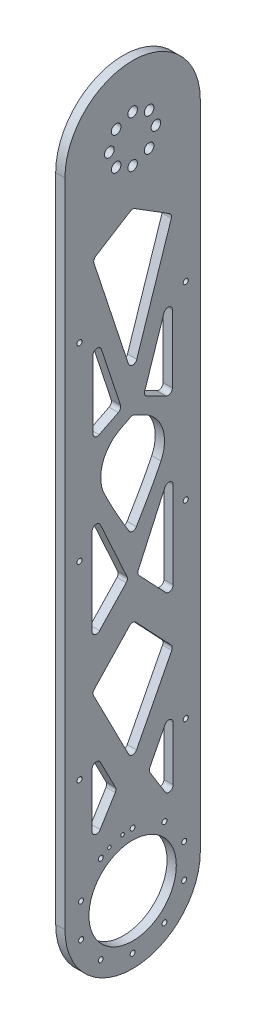
from build123d import *

# Parameters (mm, degrees)
SKETCH1_R                            = 3.3
SKETCH1_R_2                          = 1.7
SKETCH1_R_3                          = 26
BOSS_EXTRUDE1_DEPTH                  = 6.35
CUT_EXTRUDE1_DEPTH                   = 549.511460682
FILLET1_R                            = 3
SKETCH4_R                            = 1.75
CUT_EXTRUDE2_DEPTH                   = 549.511460792
SKETCH5_R                            = 1.2
CUT_EXTRUDE4_DEPTH                   = 549.511460792
BOSS_EXTRUDE2_START                  = -6.35
BOSS_EXTRUDE2_DEPTH                  = 6.35
TAP_DRILL_FOR_M3X0_5_TAP1_AT_2_COUNT = 2
TAP_DRILL_FOR_M3X0_5_TAP1_AT_2_PITCH = 13.03070812
CIRPATTERN1_COUNT                    = 2
CIRPATTERN1_ANGLE                    = 90
CUT_EXTRUDE5_DEPTH                   = 549.511460792
SKETCH10_R                           = 30
CUT_EXTRUDE6_DEPTH                   = 549.511460792
SKETCH11_W                           = 93
SKETCH11_H                           = 52.717688801
CUT_EXTRUDE7_DEPTH                   = 549.511460792
BOSS_EXTRUDE3_DEPTH                  = 6.35
SKETCH13_R                           = 1.75
CUT_EXTRUDE8_DEPTH                   = 549.511460792
SKETCH14_R                           = 1.75
BOSS_EXTRUDE4_DEPTH                  = 6.35


with BuildPart() as part:
    # Sketch1 → Boss-Extrude1 (new body)
    with BuildSketch(Plane(origin=(0, 0, 0), x_dir=(0, -1, 0), z_dir=(1, 0, 0))):
        with BuildLine():
            Line((0, 46.5), (500, 46.5))
            ThreePointArc((500, 46.5), (546.5, 0), (500, -46.5))
            Line((500, -46.5), (0, -46.5))
            ThreePointArc((0, -46.5), (-46.5, 0), (0, 46.5))
        make_face()
        with Locations(Location((-16, 0, 0), (0, 0, 90))):
            Circle(SKETCH1_R, mode=Mode.SUBTRACT)
        with Locations(Location((-11.313708499, 11.313708499, 0), (0, 0, 90))):
            Circle(SKETCH1_R, mode=Mode.SUBTRACT)
        with Locations(Location((0, 16, 0), (0, 0, 90))):
            Circle(SKETCH1_R, mode=Mode.SUBTRACT)
        with Locations(Location((11.313708499, 11.313708499, 0), (0, 0, 90))):
            Circle(SKETCH1_R, mode=Mode.SUBTRACT)
        with Locations(Location((16, 0, 0), (0, 0, 90))):
            Circle(SKETCH1_R, mode=Mode.SUBTRACT)
        with Locations(Location((11.313708499, -11.313708499, 0), (0, 0, 90))):
            Circle(SKETCH1_R, mode=Mode.SUBTRACT)
        with Locations(Location((537.25, 0, 0), (0, 0, 90))):
            Circle(SKETCH1_R_2, mode=Mode.SUBTRACT)
        with Locations(Location((530.13588304, -21.895000648, 0), (0, 0, 90))):
            Circle(SKETCH1_R_2, mode=Mode.SUBTRACT)
        with Locations(Location((511.51088304, -35.426855232, 0), (0, 0, 90))):
            Circle(SKETCH1_R_2, mode=Mode.SUBTRACT)
        with Locations(Location((488.48911696, -35.426855232, 0), (0, 0, 90))):
            Circle(SKETCH1_R_2, mode=Mode.SUBTRACT)
        with Locations(Location((469.86411696, -21.895000648, 0), (0, 0, 90))):
            Circle(SKETCH1_R_2, mode=Mode.SUBTRACT)
        with Locations(Location((462.75, 0, 0), (0, 0, 90))):
            Circle(SKETCH1_R_2, mode=Mode.SUBTRACT)
        with Locations(Location((469.86411696, 21.895000648, 0), (0, 0, 90))):
            Circle(SKETCH1_R_2, mode=Mode.SUBTRACT)
        with Locations(Location((488.48911696, 35.426855232, 0), (0, 0, 90))):
            Circle(SKETCH1_R_2, mode=Mode.SUBTRACT)
        with Locations(Location((511.51088304, 35.426855232, 0), (0, 0, 90))):
            Circle(SKETCH1_R_2, mode=Mode.SUBTRACT)
        with Locations(Location((530.13588304, 21.895000648, 0), (0, 0, 90))):
            Circle(SKETCH1_R_2, mode=Mode.SUBTRACT)
        with Locations(Location((500, 0, 0), (0, 0, 90))):
            Circle(SKETCH1_R_3, mode=Mode.SUBTRACT)
        with Locations(Location((0, -16, 0), (0, 0, 90))):
            Circle(SKETCH1_R, mode=Mode.SUBTRACT)
        with Locations(Location((-11.313708499, -11.313708499, 0), (0, 0, 90))):
            Circle(SKETCH1_R, mode=Mode.SUBTRACT)
    extrude(amount=BOSS_EXTRUDE1_DEPTH)

    # Sketch3 → Cut-Extrude1 (cut, through all)
    with BuildSketch(Plane(origin=(6.35, 0, 0), x_dir=(0, 0, -1), z_dir=(1, 0, 0))):
        Polygon((0, -422.848022722), (27.858212922, -368.632839363), (0, -339.139268075), (-27.858212922, -368.632839363), align=None)
        Polygon((0, -41.368651369), (-27.312924288, -58.435222232), (0, -141.248998295), (27.312924288, -58.435222232), align=None)
        Polygon((3, -313.189087212), (27.858212922, -339.506549748), (27.858212922, -258.646044282), align=None)
        Polygon((-27.858212922, -339.506549748), (-27.858212922, -258.646044282), (-3, -313.189087212), align=None)
        Polygon((-27.858212922, -401.452857349), (-11, -434.260816252), (-27.858212922, -461.481824785), align=None)
        Polygon((11, -434.260816252), (27.858212922, -461.481824785), (27.858212922, -401.452857349), align=None)
        with BuildLine():
            Line((0, -164.248853344), (-27.858212922, -178.200474573))
            add(Edge.make_bspline(
                [(-27.858212922, -178.200474573), (-43.7790539, -216.093343216), (-18.61661693, -258.276071598), (0, -289.085024731)],
                knots=[0, 0, 0, 0, 1, 1, 1, 1], degree=3))
            add(Edge.make_bspline(
                [(27.858212922, -178.200474573), (43.7790539, -216.093343216), (18.61661693, -258.276071598), (0, -289.085024731)],
                knots=[0, 0, 0, 0, 1, 1, 1, 1], degree=3))
            Line((27.858212922, -178.200474573), (0, -164.248853344))
        make_face()
        Polygon((7.5, -156.820958214), (27.312924288, -96.747453897), (27.312924288, -166.743432993), align=None)
        Polygon((-27.312924288, -96.747453897), (-27.312924288, -166.743432993), (-7.5, -156.820958214), align=None)
    extrude(amount=-CUT_EXTRUDE1_DEPTH, mode=Mode.SUBTRACT)

    # Fillet1
    fillet1_edges = [part.edges().sort_by_distance(p)[0] for p in [
        (3.175, -58.435222232, -27.312924288),
        (3.175, -41.368651369, 0),
        (3.175, -58.435222232, 27.312924288),
        (3.175, -141.248998295, 0),
        (3.175, -289.085024731, 0),
        (3.175, -164.248853344, 0),
        (3.175, -401.452857349, 27.858212922),
        (3.175, -434.260816252, 11),
        (3.175, -461.481824785, 27.858212922),
        (3.175, -461.481824785, -27.858212922),
        (3.175, -434.260816252, -11),
        (3.175, -401.452857349, -27.858212922),
        (3.175, -368.632839363, -27.858212922),
        (3.175, -339.139268075, 0),
        (3.175, -368.632839363, 27.858212922),
        (3.175, -422.848022722, 0),
        (3.175, -313.189087212, 3),
        (3.175, -339.506549748, 27.858212922),
        (3.175, -258.646044282, 27.858212922),
        (3.175, -178.200474573, -27.858212922),
        (3.175, -178.200474573, 27.858212922),
        (3.175, -339.506549748, -27.858212922),
        (3.175, -313.189087212, -3),
        (3.175, -258.646044282, -27.858212922),
        (3.175, -96.747453897, 27.312924288),
        (3.175, -166.743432993, 27.312924288),
        (3.175, -156.820958214, 7.5),
        (3.175, -166.743432993, -27.312924288),
        (3.175, -156.820958214, -7.5),
        (3.175, -96.747453897, -27.312924288),
    ]]
    fillet(fillet1_edges, radius=FILLET1_R)

    # Sketch4 → Cut-Extrude2 (cut, through all)
    with BuildSketch(Plane(origin=(6.35, 0, 0), x_dir=(0, 0, -1), z_dir=(1, 0, 0))):
        with Locations((-36.5, -103.175)):
            Circle(SKETCH4_R)
        with Locations(Location((36.5, -103.175, 0), (0, 0, 180))):
            Circle(SKETCH4_R)
        with Locations(Location((-36.5, -259.525, 0), (0, 0, 180))):
            Circle(SKETCH4_R)
        with Locations((36.5, -259.525)):
            Circle(SKETCH4_R)
        with Locations((-36.5, -415.875)):
            Circle(SKETCH4_R)
        with Locations(Location((36.5, -415.875, 0), (0, 0, 180))):
            Circle(SKETCH4_R)
    extrude(amount=-CUT_EXTRUDE2_DEPTH, mode=Mode.SUBTRACT)

    # Sketch5 → Cut-Extrude4 (cut, through all)
    with BuildSketch(Plane(origin=(6.35, 0, 0), x_dir=(0, 0, -1), z_dir=(1, 0, 0))):
        with Locations((-6.916110339, -463.343078174)):
            Circle(SKETCH5_R)
        with Locations((-15.951147244, -466.27873962)):
            Circle(SKETCH5_R)
    extrude(amount=-CUT_EXTRUDE4_DEPTH, mode=Mode.SUBTRACT)

    # Sketch6 → Boss-Extrude2 (add)
    with BuildSketch(Plane(origin=(6.35, 0, 0), x_dir=(0, 0, -1), z_dir=(1, 0, 0)).offset(BOSS_EXTRUDE2_START)):
        with BuildLine():
            Line((-44.110383395, -529.968247771), (-29.968247771, -544.110383395))
            ThreePointArc((-29.968247771, -544.110383395), (-23.286397782, -542.399293624), (-16.474718596, -543.483717035))
            ThreePointArc((-16.474718596, -543.483717035), (-32.880465325, -532.880465325), (-43.483717035, -516.474718596))
            ThreePointArc((-43.483717035, -516.474718596), (-42.399293624, -523.286397782), (-44.110383395, -529.968247771))
        make_face()
    boss_extrude2 = extrude(amount=BOSS_EXTRUDE2_DEPTH)

    # Sketch8 → Tap Drill for M3x0.5 Tap1 (revolve, cut)
    with BuildSketch(Plane(origin=(3.175, -532.796674896, 41.28195627), x_dir=(0, -0.7071067811865424, -0.7071067811865527), z_dir=(1, 0, 0))):
        Polygon((0, 0), (0, 5.751075774), (1.25, 5), (1.25, 0), align=None)
    tap_drill_for_m3x0_5_tap1 = revolve(axis=Axis((3.175, -537.286802956, 45.772084331), (0, 0.7071067811865529, -0.7071067811865422)), mode=Mode.SUBTRACT)

    # Tap Drill for M3x0.5 Tap1 at 2: Tap Drill for M3x0.5 Tap1 ×2
    with Locations(*[Vector(0, -0.7071067811865422, -0.7071067811865529) * (i * TAP_DRILL_FOR_M3X0_5_TAP1_AT_2_PITCH) for i in range(1, TAP_DRILL_FOR_M3X0_5_TAP1_AT_2_COUNT)]):
        add(tap_drill_for_m3x0_5_tap1, mode=Mode.SUBTRACT)

    # CirPattern1: Boss-Extrude2, Tap Drill for M3x0.5 Tap1 ×2 about axis
    cirpattern1_axis = Axis((0, -500, 0), (1, 0, 0))
    add([boss_extrude2.rotate(cirpattern1_axis, i * CIRPATTERN1_ANGLE / (CIRPATTERN1_COUNT - 1)) for i in range(1, CIRPATTERN1_COUNT)])
    add([tap_drill_for_m3x0_5_tap1.rotate(cirpattern1_axis, i * CIRPATTERN1_ANGLE / (CIRPATTERN1_COUNT - 1)) for i in range(1, CIRPATTERN1_COUNT)], mode=Mode.SUBTRACT)

    # CirPattern1 copy 1 sketch → CirPattern1 copy 1 (revolve, cut)
    with BuildSketch(Plane(origin=(3.175, -532.067854195, -42.010776971), x_dir=(0, 0.7071067811865551, -0.7071067811865399), z_dir=(1, 0, 0))):
        Polygon((0, 0), (0, 5.751075774), (1.25, 5), (1.25, 0), align=None)
    revolve(axis=Axis((3.175, -536.557982255, -46.500905032), (0, 0.7071067811865398, 0.7071067811865553)), mode=Mode.SUBTRACT)

    # Sketch9 → Cut-Extrude5 (cut, through all)
    with BuildSketch(Plane(origin=(6.35, 0, 0), x_dir=(0, 0, -1), z_dir=(1, 0, 0))):
        with BuildLine():
            Line((-43.483717035, -516.474718596), (-63.483717035, -516.474718596))
            ThreePointArc((-63.483717035, -516.474718596), (0, -565.586573942), (63.483717035, -516.474718596))
            Line((63.483717035, -516.474718596), (43.483717035, -516.474718596))
            ThreePointArc((43.483717035, -516.474718596), (0, -546.5), (-43.483717035, -516.474718596))
        make_face()
    extrude(amount=-CUT_EXTRUDE5_DEPTH, mode=Mode.SUBTRACT)

    # Sketch10 → Cut-Extrude6 (cut, through all)
    with BuildSketch(Plane(origin=(6.35, 0, 0), x_dir=(0, 0, -1), z_dir=(1, 0, 0))):
        with Locations((0, -500)):
            Circle(SKETCH10_R)
    extrude(amount=-CUT_EXTRUDE6_DEPTH, mode=Mode.SUBTRACT)

    # Sketch11 → Cut-Extrude7 (cut, through all)
    with BuildSketch(Plane.ZY):
        with Locations((0, -205.625859872)):
            Rectangle(SKETCH11_W, SKETCH11_H)
    extrude(amount=-CUT_EXTRUDE7_DEPTH, mode=Mode.SUBTRACT)


with BuildPart() as cut_extrude7_piece_1:
    # of the separate pieces the step leaves, piece 1, a body of its own (cut_extrude7_pieces)
    add(part.part.solids().sort_by_distance((0, -500, 46.5))[0])


with BuildPart() as cut_extrude7_piece_2:
    # of the separate pieces the step leaves, piece 2, a body of its own (cut_extrude7_pieces)
    add(part.part.solids().sort_by_distance((0, -179.267015471, 46.5))[0])


with BuildPart() as cut_extrude7_piece_2_1:
    # Body-Move/Copy1: moved
    add(cut_extrude7_piece_2.part.moved(Location((0, -52.7176888, 0))))

    # Combine1: union Cut-Extrude7 piece 1
    add(cut_extrude7_piece_1.part)

    # Sketch12 → Boss-Extrude3 (add)
    with BuildSketch(Plane.ZY):
        with BuildLine():
            Line((-8.107077378, -221.026632904), (-26.8521577, -230.414322677))
            ThreePointArc((-26.8521577, -230.414322677), (-27.717865763, -231.066969848), (-28.295067899, -231.984704273))
            add(Edge.make_bspline(
                [(-19.477332048, -254.141993575), (-22.908456866, -246.947780666), (-25.966776611, -239.522857913), (-28.295067899, -231.984704273)],
                knots=[0.341715687, 0.341715687, 0.341715687, 0.341715687, 0.53746001, 0.53746001, 0.53746001, 0.53746001], degree=3))
            ThreePointArc((-19.477332048, -254.141993575), (-20.557337263, -235.261485452), (-8.107077378, -221.026632904))
        make_face()
        with BuildLine():
            Line((8.107077378, -221.026632904), (26.8521577, -230.414322677))
            ThreePointArc((26.8521577, -230.414322677), (27.717865763, -231.066969848), (28.295067899, -231.984704273))
            add(Edge.make_bspline(
                [(19.477332048, -254.141993575), (22.908456866, -246.947780666), (25.966776611, -239.522857913), (28.295067899, -231.984704273)],
                knots=[0.341715687, 0.341715687, 0.341715687, 0.341715687, 0.53746001, 0.53746001, 0.53746001, 0.53746001], degree=3))
            ThreePointArc((19.477332048, -254.141993575), (20.557337263, -235.261485452), (8.107077378, -221.026632904))
        make_face()
    extrude(amount=-BOSS_EXTRUDE3_DEPTH)

    # Sketch13 → Cut-Extrude8 (cut, through all)
    with BuildSketch(Plane.ZY):
        with Locations((-36.5, -285.8838444)):
            Circle(SKETCH13_R)
        with Locations((36.5, -285.8838444)):
            Circle(SKETCH13_R)
    extrude(amount=-CUT_EXTRUDE8_DEPTH, mode=Mode.SUBTRACT)

    # Sketch14 → Boss-Extrude4 (add)
    with BuildSketch(Plane(origin=(6.35, 0, 0), x_dir=(0, 0, -1), z_dir=(1, 0, 0))):
        with Locations((36.5, -259.525)):
            Circle(SKETCH14_R)
        with Locations((-36.5, -259.525)):
            Circle(SKETCH14_R)
    extrude(amount=-BOSS_EXTRUDE4_DEPTH)


solid = cut_extrude7_piece_2_1.part
